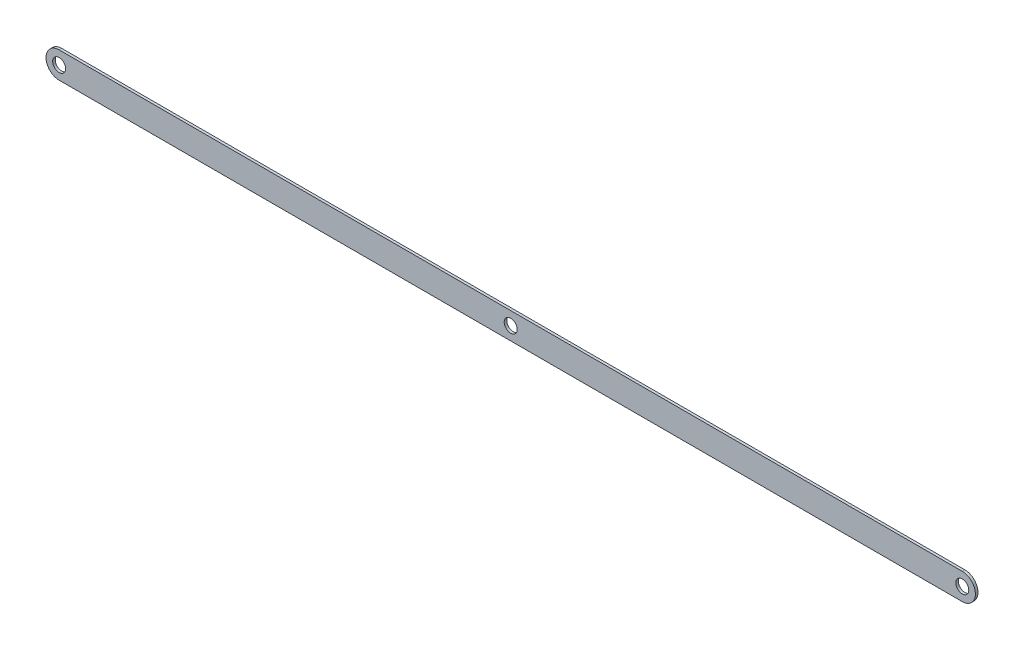
from build123d import *

# Parameters (mm, degrees)
BOSS_EXTRUDE1_DEPTH = 10
SKETCH2_R           = 25
CUT_EXTRUDE1_DEPTH  = 10


with BuildPart() as part:
    # Sketch1 → Boss-Extrude1 (new body)
    with BuildSketch(Plane.XY):
        with BuildLine():
            Line((-1738.65, 50.590045249), (1738.65, 50.590045249))
            ThreePointArc((1738.65, 50.590045249), (1789.240045249, 0), (1738.65, -50.590045249))
            Line((1738.65, -50.590045249), (-1738.65, -50.590045249))
            ThreePointArc((-1738.65, -50.590045249), (-1789.240045249, 0), (-1738.65, 50.590045249))
        make_face()
    extrude(amount=BOSS_EXTRUDE1_DEPTH)

    # Sketch2 → Cut-Extrude1 (cut)
    with BuildSketch(Plane.XY.offset(10)):
        Circle(SKETCH2_R)
        with Locations((-1738.65, 0)):
            Circle(SKETCH2_R)
        with Locations((1738.65, 0)):
            Circle(SKETCH2_R)
    extrude(amount=-CUT_EXTRUDE1_DEPTH, mode=Mode.SUBTRACT)


solid = part.part
